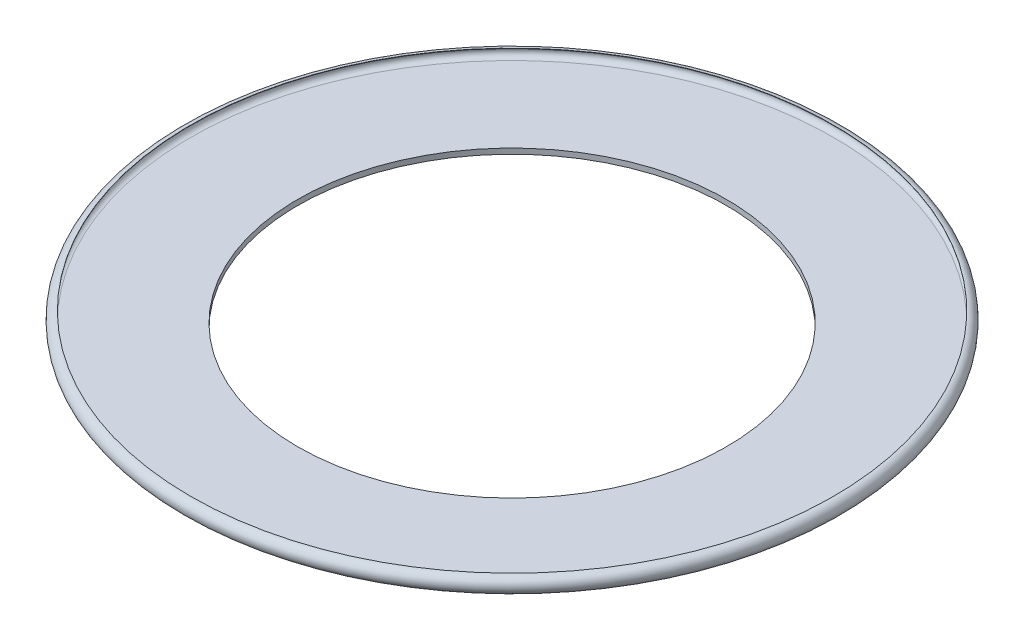
from build123d import *

# Parameters (mm, degrees)
SKETCH1_R           = 152.4
SKETCH1_R_2         = 101.6
BOSS_EXTRUDE1_DEPTH = 2.54


with BuildPart() as part:
    # Sketch1 → Boss-Extrude1 (new body)
    with BuildSketch(Plane(origin=(0, 0, 0), x_dir=(1, 0, 0), z_dir=(0, 1, 0))):
        with Locations(Location((0, 0, 0), (0, 0, 270))):
            Circle(SKETCH1_R)
        with Locations(Location((0, 0, 0), (0, 0, 270))):
            Circle(SKETCH1_R_2, mode=Mode.SUBTRACT)
    extrude(amount=BOSS_EXTRUDE1_DEPTH)

    # Sketch3 → Revolve1 (revolve)
    with BuildSketch(Plane(origin=(0, 0, 0), x_dir=(0, 0, -1), z_dir=(1, 0, 0))):
        with BuildLine():
            Line((-152.4, 7.62), (-152.4, 7.4676))
            ThreePointArc((-152.4, 7.4676), (-154.8638, 5.0038), (-152.4, 2.54))
            Line((-152.4, 2.54), (-152.4, 0))
            ThreePointArc((-152.4, 0), (-156.21, 3.81), (-152.4, 7.62))
        make_face()
    revolve(axis=Axis((0, 70.54833347, 0), (0, -1, 0)))


solid = part.part
